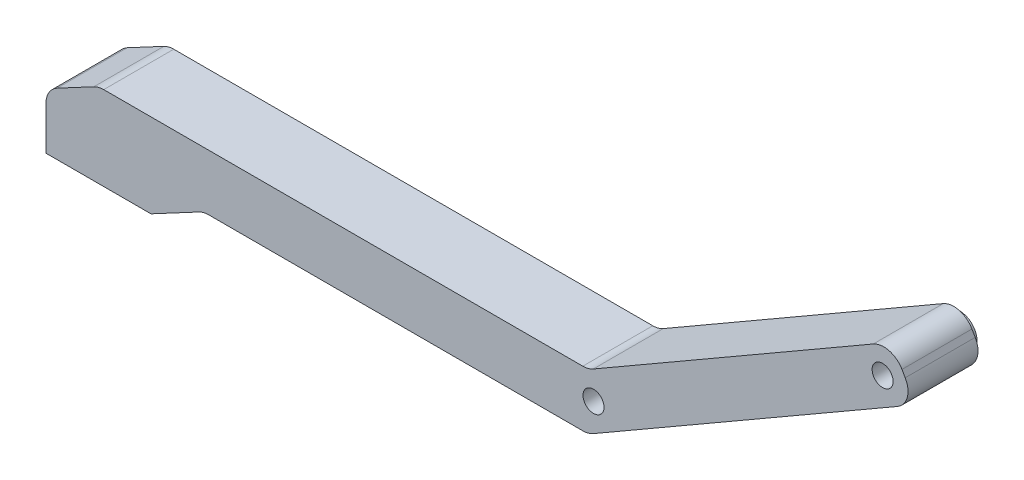
from build123d import *

# Parameters (mm, degrees)
SKETCH_1_R      = 1.5
EXTRUDE_1_DEPTH = 10
FILLET_1_R      = 3
EXTRUDE_START   = -11
SKETCH_2_R      = 2.5
SKETCH_2_R_2    = 1.5
EXTRUDE_2_DEPTH = 11


with BuildPart() as part:
    # 草图1 → 凸台-拉伸1 (new body)
    with BuildSketch(Plane.XY):
        Polygon((-7.5, 4), (-7.5, -4), (7.5, -4), (15, 0), (70, 0), (116.765371804, 27), (113.301270189, 33), (70, 8), (0, 8), align=None)
        with Locations((112.0368731, 28.27)):
            Circle(SKETCH_1_R, mode=Mode.SUBTRACT)
        with Locations((70.727461339, 4.42)):
            Circle(SKETCH_1_R, mode=Mode.SUBTRACT)
    extrude(amount=EXTRUDE_1_DEPTH)

    # 圆角1
    fillet_1_edges = [part.edges().sort_by_distance(p)[0] for p in [
        (-7.5, 4, 5),
        (0, 8, 5),
        (70, 8, 5),
        (113.301270189, 33, 5),
        (116.765371804, 27, 5),
        (70, 0, 5),
        (15, 0, 5),
    ]]
    fillet(fillet_1_edges, radius=FILLET_1_R)

    # 草图2 → 凸台-拉伸2 (add)
    with BuildSketch(Plane.XY.offset(10).offset(EXTRUDE_START)):
        with Locations((112.0368731, 28.27)):
            Circle(SKETCH_2_R)
        with Locations((112.0368731, 28.27)):
            Circle(SKETCH_2_R_2, mode=Mode.SUBTRACT)
    extrude(amount=EXTRUDE_2_DEPTH)


solid = part.part
